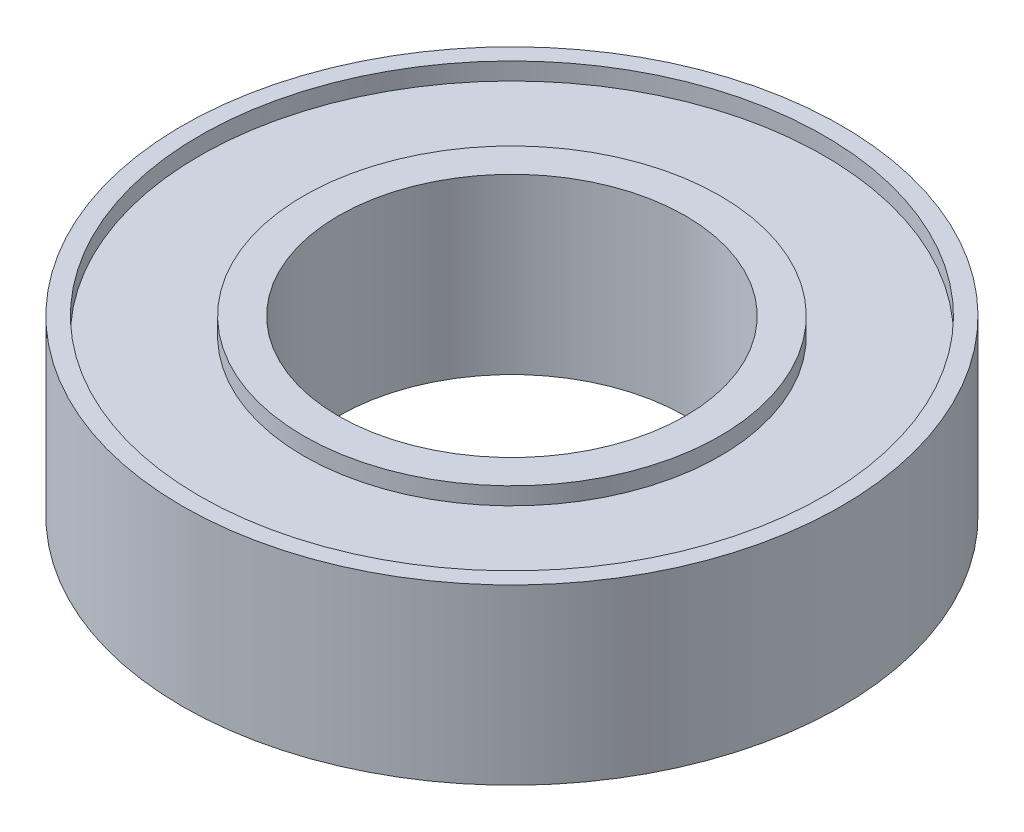
from build123d import *

# Parameters (mm, degrees)
SKETCH1_R           = 9.5
SKETCH1_R_2         = 5
BOSS_EXTRUDE1_DEPTH = 5
SKETCH2_R           = 9
SKETCH2_R_2         = 6
CUT_EXTRUDE1_DEPTH  = 0.5
CUT_EXTRUDE2_START  = -0.5
SKETCH3_R           = 9
SKETCH3_R_2         = 6
CUT_EXTRUDE2_DEPTH  = 0.5


with BuildPart() as part:
    # Sketch1 → Boss-Extrude1 (new body)
    with BuildSketch(Plane(origin=(0, 0, 0), x_dir=(1, 0, 0), z_dir=(0, 1, 0))):
        with Locations(Location((0, 0, 0), (0, 0, 270))):
            Circle(SKETCH1_R)
        with Locations(Location((0, 0, 0), (0, 0, 270))):
            Circle(SKETCH1_R_2, mode=Mode.SUBTRACT)
    extrude(amount=BOSS_EXTRUDE1_DEPTH)

    # Sketch2 → Cut-Extrude1 (cut)
    with BuildSketch(Plane(origin=(0, 5, 0), x_dir=(1, 0, 0), z_dir=(0, 1, 0))):
        with Locations(Location((0, 0, 0), (0, 0, 270))):
            Circle(SKETCH2_R)
        with Locations(Location((0, 0, 0), (0, 0, 270))):
            Circle(SKETCH2_R_2, mode=Mode.SUBTRACT)
    extrude(amount=-CUT_EXTRUDE1_DEPTH, mode=Mode.SUBTRACT)

    # Sketch3 → Cut-Extrude2 (cut)
    with BuildSketch(Plane.XZ.offset(CUT_EXTRUDE2_START)):
        with Locations(Location((0, 0, 0), (0, 0, 90))):
            Circle(SKETCH3_R)
        with Locations(Location((0, 0, 0), (0, 0, 90))):
            Circle(SKETCH3_R_2, mode=Mode.SUBTRACT)
    extrude(amount=CUT_EXTRUDE2_DEPTH, mode=Mode.SUBTRACT)


solid = part.part
